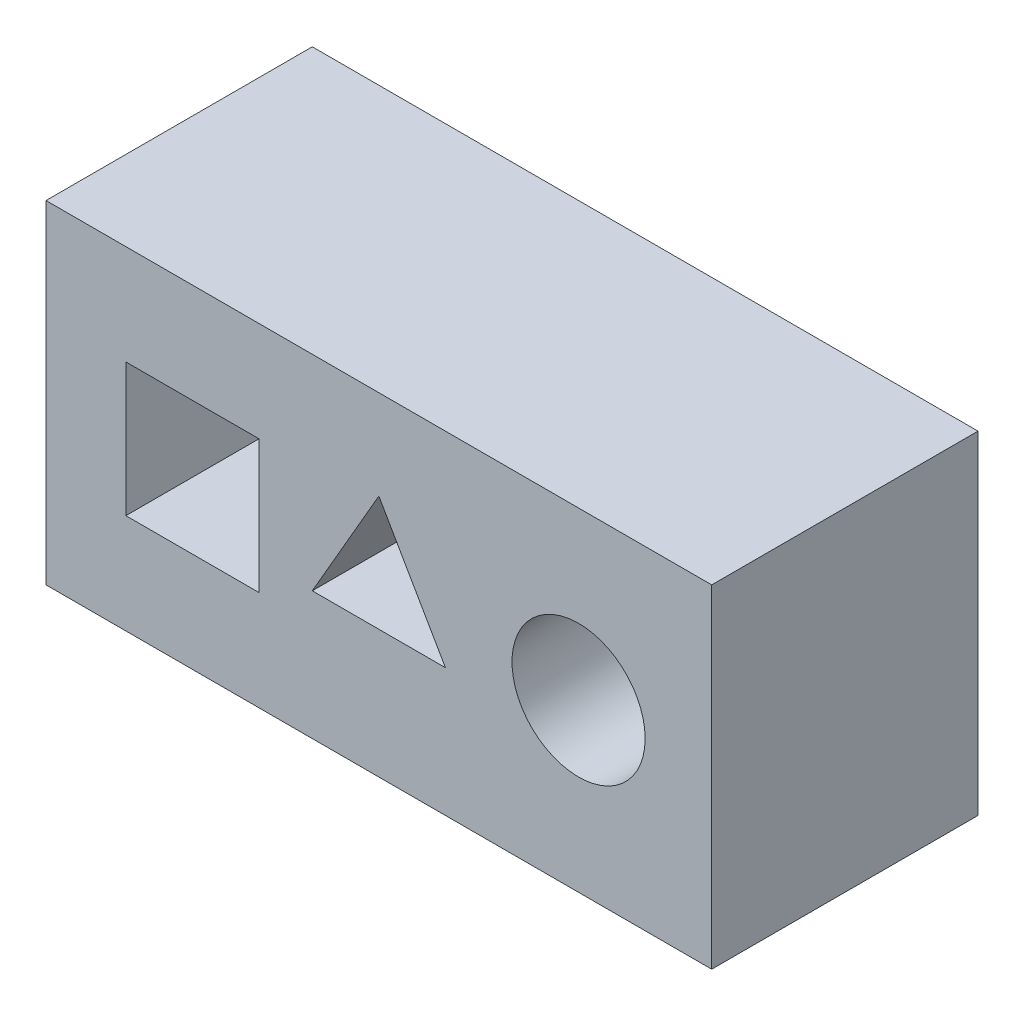
from build123d import *

# Parameters (mm, degrees)
SKETCH1_W           = 250
SKETCH1_H           = 125
SKETCH1_W_2         = 230
SKETCH1_H_2         = 115
BOSS_EXTRUDE1_DEPTH = 100
SKETCH3_W           = 250
SKETCH3_H           = 125
SKETCH3_W_2         = 230
SKETCH3_H_2         = 115
SKETCH3_R           = 25
SKETCH3_W_3         = 50
SKETCH3_H_3         = 50
BOSS_EXTRUDE4_DEPTH = 100


with BuildPart() as part:
    # Sketch1 → Boss-Extrude1 (new body)
    with BuildSketch(Plane.XY):
        Rectangle(SKETCH1_W, SKETCH1_H)
        Rectangle(SKETCH1_W_2, SKETCH1_H_2, mode=Mode.SUBTRACT)
    extrude(amount=BOSS_EXTRUDE1_DEPTH)

    # Sketch3 → Boss-Extrude4 (add)
    # profile 1 of 2: a face of its own
    with BuildSketch(Plane.XY.offset(100)):
        Rectangle(SKETCH3_W, SKETCH3_H)
        Rectangle(SKETCH3_W_2, SKETCH3_H_2, mode=Mode.SUBTRACT)
    # profile 2 of 2: a face of its own
    with BuildSketch(Plane.XY.offset(100)):
        Rectangle(SKETCH3_W_2, SKETCH3_H_2)
        with Locations((75, 0)):
            Circle(SKETCH3_R, mode=Mode.SUBTRACT)
        with Locations((-70, 0)):
            Rectangle(SKETCH3_W_3, SKETCH3_H_3, mode=Mode.SUBTRACT)
        Polygon((0, 28.867513459), (25, -14.43375673), (-25, -14.43375673), align=None, mode=Mode.SUBTRACT)
    extrude(amount=-BOSS_EXTRUDE4_DEPTH)


solid = part.part
